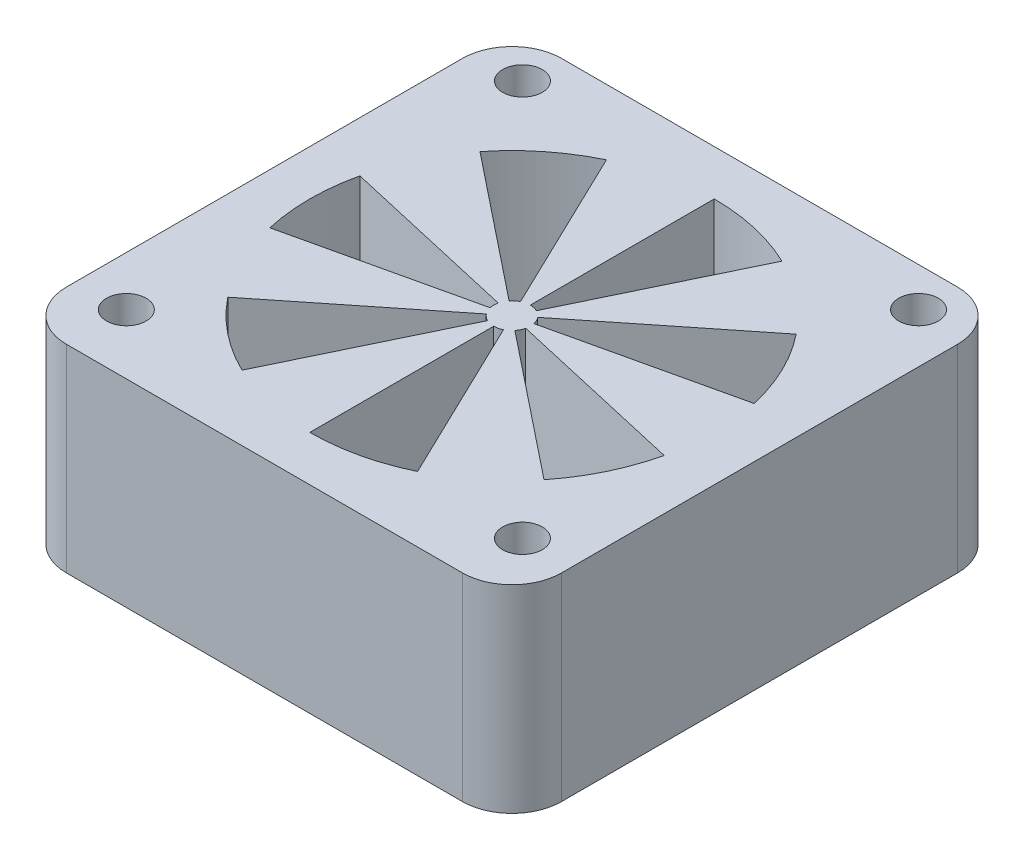
from build123d import *

# Parameters (mm, degrees)
SKETCH_1_W          = 50
SKETCH_1_H          = 50
EXTRUDE_1_DEPTH     = 20
SKETCH_2_R          = 2
CUT_EXTRUDE_1_DEPTH = 20
CUT_EXTRUDE_2_DEPTH = 20
FILLET_1_R          = 5


with BuildPart() as part:
    # 草图1 → 凸台-拉伸1 (new body)
    with BuildSketch(Plane(origin=(0, 0, 0), x_dir=(1, 0, 0), z_dir=(0, 1, 0))):
        with Locations((25, -25)):
            Rectangle(SKETCH_1_W, SKETCH_1_H)
    extrude(amount=EXTRUDE_1_DEPTH)

    # 草图2 → 切除-拉伸1 (cut)
    with BuildSketch(Plane(origin=(0, 20, 0), x_dir=(1, 0, 0), z_dir=(0, 1, 0))):
        with Locations(Location((5, -3.945505115, 0), (0, 0, 270))):
            Circle(SKETCH_2_R)
        with Locations(Location((45, -3.945505115, 0), (0, 0, 270))):
            Circle(SKETCH_2_R)
        with Locations(Location((5, -43.945505115, 0), (0, 0, 270))):
            Circle(SKETCH_2_R)
        with Locations(Location((45, -43.945505115, 0), (0, 0, 270))):
            Circle(SKETCH_2_R)
    extrude(amount=-CUT_EXTRUDE_1_DEPTH, mode=Mode.SUBTRACT)

    # 草图3 → 切除-拉伸2 (cut)
    with BuildSketch(Plane(origin=(0, 20, 0), x_dir=(1, 0, 0), z_dir=(0, 1, 0))):
        with BuildLine():
            Line((25, -23.155221491), (25, -4.579448382))
            ThreePointArc((25, -4.579448382), (29.544000218, -5.091434245), (33.860145291, -6.601718727))
            Line((33.860145291, -6.601718727), (25.800419398, -23.337911995))
            ThreePointArc((25.800419398, -23.337911995), (25.410501837, -23.201473939), (25, -23.155221491))
        make_face()
        with BuildLine():
            Line((26.442305917, -23.849799413), (40.965430144, -12.267994318))
            ThreePointArc((40.965430144, -12.267994318), (43.398281273, -16.139854709), (44.908565755, -20.455999782))
            Line((44.908565755, -20.455999782), (26.798526061, -24.589498163))
            ThreePointArc((26.798526061, -24.589498163), (26.662088005, -24.199580602), (26.442305917, -23.849799413))
        make_face()
        with BuildLine():
            Line((26.798526061, -25.410501837), (44.908565755, -29.544000218))
            ThreePointArc((44.908565755, -29.544000218), (43.398281273, -33.860145291), (40.965430144, -37.732005682))
            Line((40.965430144, -37.732005682), (26.442305917, -26.150200587))
            ThreePointArc((26.442305917, -26.150200587), (26.662088005, -25.800419398), (26.798526061, -25.410501837))
        make_face()
        with BuildLine():
            Line((25.800419398, -26.662088005), (33.860145291, -43.398281273))
            ThreePointArc((33.860145291, -43.398281273), (29.544000218, -44.908565755), (25, -45.420551618))
            Line((25, -45.420551618), (25, -26.844778509))
            ThreePointArc((25, -26.844778509), (25.410501837, -26.798526061), (25.800419398, -26.662088005))
        make_face()
        with BuildLine():
            Line((24.199580602, -26.662088005), (16.139854709, -43.398281273))
            ThreePointArc((16.139854709, -43.398281273), (12.267994318, -40.965430144), (9.034569856, -37.732005682))
            Line((9.034569856, -37.732005682), (23.557694083, -26.150200587))
            ThreePointArc((23.557694083, -26.150200587), (23.849799413, -26.442305917), (24.199580602, -26.662088005))
        make_face()
        with BuildLine():
            Line((23.201473939, -25.410501837), (5.091434245, -29.544000218))
            ThreePointArc((5.091434245, -29.544000218), (4.579448382, -25), (5.091434245, -20.455999782))
            Line((5.091434245, -20.455999782), (23.201473939, -24.589498163))
            ThreePointArc((23.201473939, -24.589498163), (23.155221491, -25), (23.201473939, -25.410501837))
        make_face()
        with BuildLine():
            Line((23.557694083, -23.849799413), (9.034569856, -12.267994318))
            ThreePointArc((9.034569856, -12.267994318), (12.267994318, -9.034569856), (16.139854709, -6.601718727))
            Line((16.139854709, -6.601718727), (24.199580602, -23.337911995))
            ThreePointArc((24.199580602, -23.337911995), (23.849799413, -23.557694083), (23.557694083, -23.849799413))
        make_face()
    extrude(amount=-CUT_EXTRUDE_2_DEPTH, mode=Mode.SUBTRACT)

    # 圆角1
    fillet_1_edges = [part.edges().sort_by_distance(p)[0] for p in [
        (0, 10, 0),
        (50, 10, 0),
        (50, 10, 50),
        (0, 10, 50),
    ]]
    fillet(fillet_1_edges, radius=FILLET_1_R)


solid = part.part
